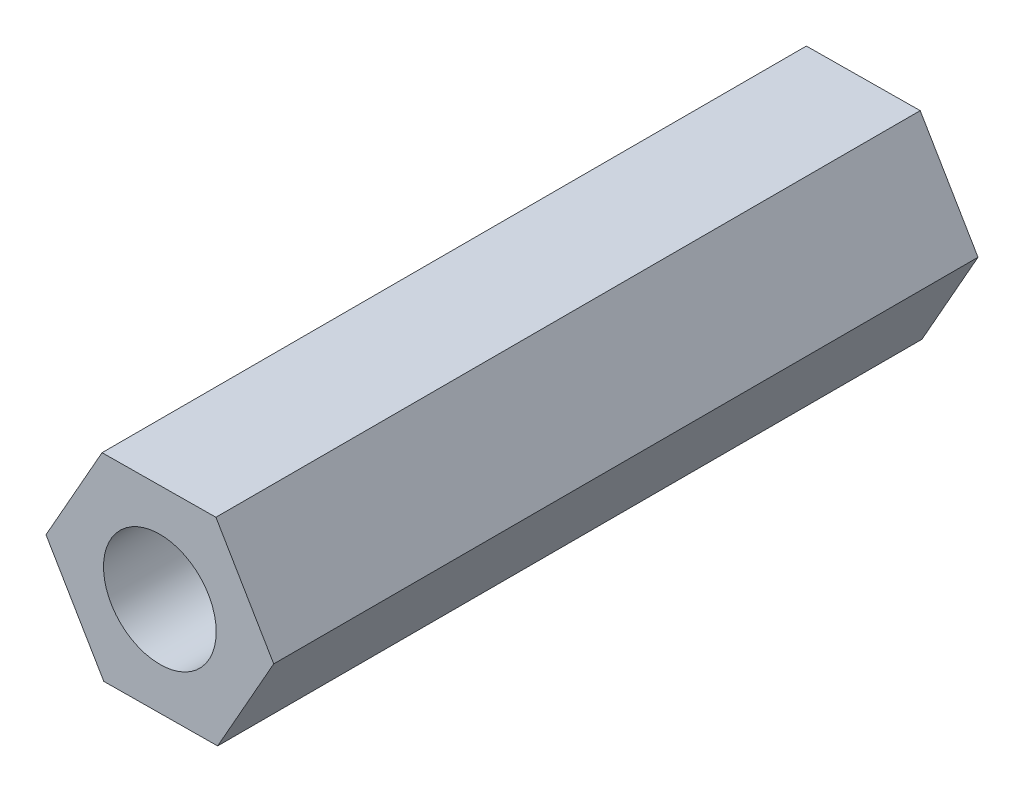
from build123d import *

# Parameters (mm, degrees)
SKETCH_1_R      = 2
EXTRUDE_1_DEPTH = 25


with BuildPart() as part:
    # 草图1 → 凸台-拉伸1 (new body)
    with BuildSketch(Plane.XY):
        Polygon((2.051456248, -3.482077052), (4.041295309, 0.035574699), (1.989839061, 3.517651751), (-2.051456248, 3.482077052), (-4.041295309, -0.035574699), (-1.989839061, -3.517651751), align=None)
        Circle(SKETCH_1_R, mode=Mode.SUBTRACT)
    extrude(amount=EXTRUDE_1_DEPTH)


solid = part.part
